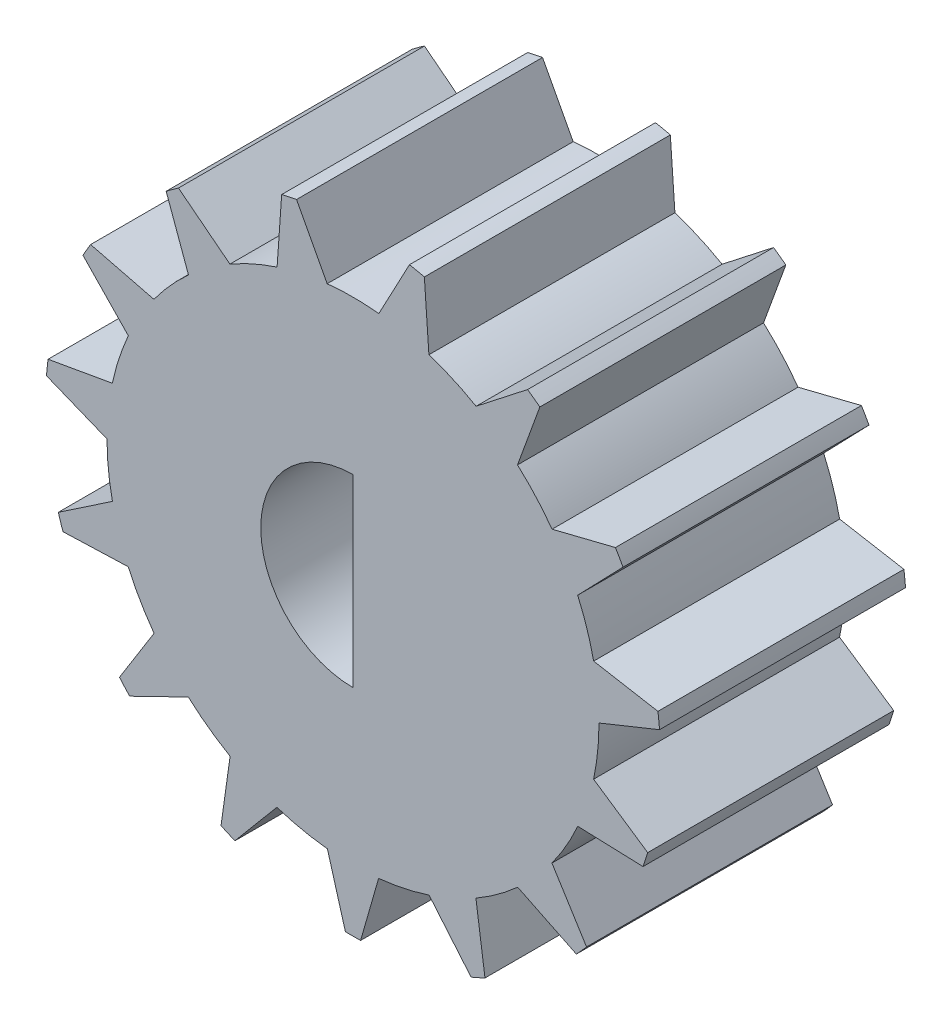
from build123d import *

# Parameters (mm, degrees)
SKETCH1_R           = 2.5
BOSS_EXTRUDE1_DEPTH = 2
CUT_EXTRUDE2_DEPTH  = 2
CIRPATTERN2_COUNT   = 15


with BuildPart() as part:
    # Sketch1 → Boss-Extrude1 (new body)
    with BuildSketch(Plane.XY):
        Circle(SKETCH1_R)
        with BuildLine():
            Line((0, 0.75), (0, -0.75))
            ThreePointArc((0, -0.75), (-0.75, 0), (0, 0.75))
        make_face(mode=Mode.SUBTRACT)
    extrude(amount=BOSS_EXTRUDE1_DEPTH)

    # Sketch2 → Cut-Extrude2 (cut)
    with BuildSketch(Plane.XY.offset(2)):
        with BuildLine():
            ThreePointArc((-0.21, 1.988944444), (-0.105145406, 1.997234199), (0, 2))
            Line((0, 2), (0, 2.514078411))
            ThreePointArc((0, 2.514078411), (-0.2340411, 2.503161005), (-0.466049549, 2.470503607))
            Line((-0.466049549, 2.470503607), (-0.21, 1.988944444))
        make_face()
        with BuildLine():
            Line((0, 2.514078411), (0, 2))
            ThreePointArc((0, 2), (0.105145406, 1.997234199), (0.21, 1.988944444))
            Line((0.21, 1.988944444), (0.466049549, 2.470503607))
            ThreePointArc((0.466049549, 2.470503607), (0.2340411, 2.503161005), (0, 2.514078411))
        make_face()
    cut_extrude2 = extrude(amount=-CUT_EXTRUDE2_DEPTH, mode=Mode.SUBTRACT)

    # CirPattern2: Cut-Extrude2 ×15 about axis
    cirpattern2_axis = Axis((0, 0, 0), (0, 0, 1))
    for i in range(1, CIRPATTERN2_COUNT):
        add(cut_extrude2.rotate(cirpattern2_axis, i * 360 / CIRPATTERN2_COUNT), mode=Mode.SUBTRACT)


solid = part.part
